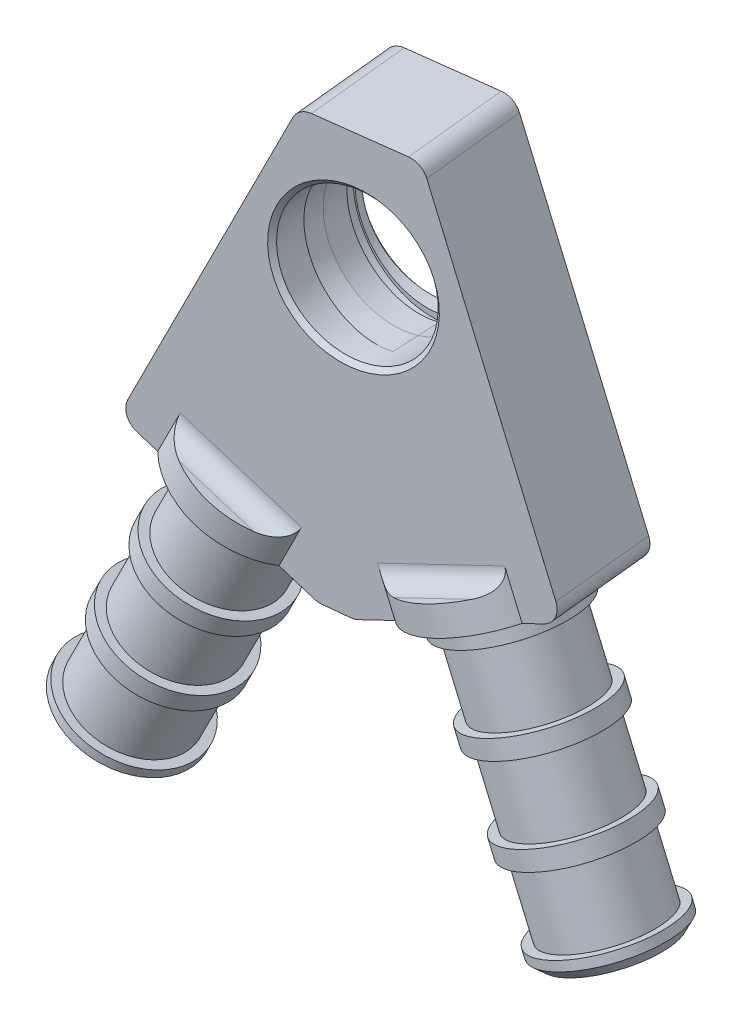
from build123d import *

# Parameters (mm, degrees)
BOSS_EXTRUDE1_DEPTH     = 6
FILLET1_R               = 2
SKETCH2_R               = 9.000000000000037
BOSS_EXTRUDE2_DEPTH     = 3
SKETCH4_R               = 5.999999999999989
BOSS_EXTRUDE4_DEPTH     = 31
SKETCH7_R               = 7.000000000000042
SKETCH7_R_2             = 6.0000000000002185
BOSS_EXTRUDE5_DEPTH     = 2
LPATTERN1_COUNT         = 4
LPATTERN1_PITCH         = 9.666666666666666
CHAMFER1_SIZE           = 1
SKETCH10_R              = 8.999999999999813
BOSS_EXTRUDE6_DEPTH     = 3
SKETCH11_R              = 6.000000000000097
BOSS_EXTRUDE7_DEPTH     = 31
SKETCH12_R              = 6.999999999999927
SKETCH12_R_2            = 6.000000000000561
BOSS_EXTRUDE8_DEPTH     = 2
LPATTERN2_COUNT         = 4
LPATTERN2_PITCH         = 9.666666666666666
CHAMFER2_SIZE           = 1
FILLET2_R               = 2
CHAMFER3_SIZE           = 0.5
CUT_EXTRUDE1_DEPTH      = 3
CUT_EXTRUDE1_DEPTH_BACK = 2
SKETCH14_R              = 7.999999999999987
CUT_EXTRUDE2_START      = -2.5
SKETCH15_R              = 8.75000000000004
CUT_EXTRUDE2_DEPTH      = 1.05


with BuildPart() as part:
    # Sketch1 → Boss-Extrude1 (new, symmetric)
    with BuildSketch(Plane(origin=(40.22848605021182, 10.507440386249398, 304.21541689712456), x_dir=(0.9913798815676159, -0.004522624098671365, -0.13094073580915158), z_dir=(0.13101881705686366, 0.03422133281336, 0.9907890643106118))):
        with BuildLine():
            Line((1125.7923568942253, 582.4609465073789), (1113.5581017730187, 582.460946507379))
            Line((1113.5581017730187, 582.460946507379), (1096.8813358766208, 546.245672674871))
            Line((1096.8813358766208, 546.245672674871), (1106.8728718457214, 541.6446718078677))
            Line((1106.8728718457214, 541.6446718078674), (1116.074873579728, 561.6277437460691))
            ThreePointArc((1116.0748735797279, 561.6277437460692), (1115.106514314083, 575.631134327019), (1127.4210560284578, 568.8943153599605))
            ThreePointArc((1127.4210560284578, 568.8943153599605), (1126.0556576867325, 564.424185514417), (1122.425540819453, 561.479932638474))
            Line((1122.425540819453, 561.4799326384739), (1130.68787399469, 541.090380154386))
            Line((1130.68787399469, 541.090380154386), (1140.8826502367342, 545.2215467420046))
            Line((1140.8826502367342, 545.2215467420046), (1125.7923568942253, 582.4609465073789))
        make_face()
        with BuildLine():
            Line((1116.074873579728, 561.6277437460691), (1106.8728718457214, 541.6446718078674))
            Line((1106.8728718457214, 541.6446718078677), (1116.8644078148222, 537.0436709408642))
            Line((1116.8644078148222, 537.0436709408642), (1120.4930977526462, 536.9592135667675))
            Line((1120.4930977526462, 536.9592135667675), (1130.68787399469, 541.090380154386))
            Line((1130.68787399469, 541.090380154386), (1122.425540819453, 561.4799326384739))
            ThreePointArc((1122.425540819453, 561.479932638474), (1119.2349072889845, 560.896481362759), (1116.0748735797279, 561.6277437460692))
        make_face()
    extrude(amount=BOSS_EXTRUDE1_DEPTH, both=True)

    # Fillet1
    fillet1_edges = [part.edges().sort_by_distance(p)[0] for p in [
        (1147.4653903967558, 542.1798998731624, 139.43421828086267),
        (1128.0476313564752, 551.5694575543945, 144.70554073394916),
        (1144.580641555777, 587.6877259897925, 141.2717616925557),
        (1155.9233230465654, 587.4270670558717, 133.72506493904436),
        (1170.8835362732825, 550.1416125523617, 133.03459355934973),
        (1151.0628005975614, 542.0790816312547, 138.96199032516412),
    ]]
    fillet(fillet1_edges, radius=FILLET1_R)

    # Sketch2 → Boss-Extrude2 (add)
    with BuildSketch(Plane(origin=(395.9915846248843, 865.0893079497423, -82.24440603747578), x_dir=(-0.9099731182582202, 0.41280589206970897, -0.03924563058409188), z_dir=(-0.41466724496566065, -0.9058884428480648, 0.08612319703132973))):
        with Locations((-814.9344009695442, -191.70601494572279)):
            Circle(SKETCH2_R)
    extrude(amount=-BOSS_EXTRUDE2_DEPTH)

    # Sketch4 → Boss-Extrude4 (add)
    with BuildSketch(Plane(origin=(395.9915846248843, 865.0893079497423, -82.24440603747578), x_dir=(-0.9099731182582202, 0.41280589206970897, -0.03924563058409188), z_dir=(-0.41466724496566065, -0.9058884428480648, 0.08612319703132973))):
        with Locations(Location((-814.9344009695399, -191.7060149457234, 0), (0, 0, 177.742421012))):
            Circle(SKETCH4_R)
    extrude(amount=BOSS_EXTRUDE4_DEPTH)

    # Sketch7 → Boss-Extrude5 (add)
    with BuildSketch(Plane(origin=(395.9915846248843, 865.0893079497423, -82.24440603747578), x_dir=(-0.9099731182582202, 0.41280589206970897, -0.03924563058409188), z_dir=(-0.41466724496566065, -0.9058884428480648, 0.08612319703132973))):
        with Locations(Location((-814.9344009695399, -191.7060149457234, 0), (0, 0, 177.742421012))):
            Circle(SKETCH7_R)
        with Locations(Location((-814.9344009695399, -191.7060149457234, 0), (0, 0, 177.742421012))):
            Circle(SKETCH7_R_2, mode=Mode.SUBTRACT)
    boss_extrude5 = extrude(amount=BOSS_EXTRUDE5_DEPTH)

    # LPattern1: Boss-Extrude5 ×4
    with Locations(*[Vector(-0.41466724496565566, -0.9058884428480669, 0.08612319703133149) * (i * LPATTERN1_PITCH) for i in range(1, LPATTERN1_COUNT)]):
        add(boss_extrude5)

    # Chamfer1
    chamfer1_edges = [part.edges().sort_by_distance(p)[0] for p in [
        (1118.3404302588897, 521.654300809395, 143.25351501891666),
    ]]
    chamfer(chamfer1_edges, length=CHAMFER1_SIZE)

    # Sketch9 → Cut-Revolve1 (revolve, cut)
    with BuildSketch(Plane(origin=(701.3399119759364, -328.7734016214342, -81.38731494870906), x_dir=(0.09461756399583972, -0.04435472420271057, 0.9945251002485532), z_dir=(-0.900491613247789, 0.42213153103599016, 0.10449796637066838))):
        with BuildLine():
            Line((225.877486562659, 947.0804844817654), (230.36058184932747, 947.4701723705318))
            Line((230.36058184932747, 947.4701723705318), (228.51317259887966, 968.7233648406637))
            ThreePointArc((228.51317259887966, 968.7233648406637), (226.92455344142695, 971.779254978499), (223.64038942344484, 972.8167722385658))
            Line((223.64038942344484, 972.8167722385658), (225.877486562659, 947.0804844817654))
        make_face()
    revolve(axis=Axis((1135.417535218711, 542.1429230931792, 141.0286657622679), (-0.41466724496565976, -0.9058884428480652, 0.08612319703132981)), mode=Mode.SUBTRACT)

    # Sketch10 → Boss-Extrude6 (add)
    with BuildSketch(Plane(origin=(-28.60916021936566, 71.30283008518833, 1.3204227793553287), x_dir=(-0.9281031291481225, -0.3722593970186158, -0.006893692537381721), z_dir=(0.3723232220335758, -0.9279440302990668, -0.017184148709241842))):
        with Locations((-1281.9468219791854, -127.34853607341212)):
            Circle(SKETCH10_R)
    extrude(amount=-BOSS_EXTRUDE6_DEPTH)

    # Sketch11 → Boss-Extrude7 (add)
    with BuildSketch(Plane(origin=(-28.60916021936566, 71.30283008518833, 1.3204227793553287), x_dir=(-0.9281031291481225, -0.3722593970186158, -0.006893692537381721), z_dir=(0.3723232220335758, -0.9279440302990668, -0.017184148709241842))):
        with Locations(Location((-1281.9468219791854, -127.34853607341212, 0), (0, 0, 179.604959052))):
            Circle(SKETCH11_R)
    extrude(amount=BOSS_EXTRUDE7_DEPTH)

    # Sketch12 → Boss-Extrude8 (add)
    with BuildSketch(Plane(origin=(-28.60916021936566, 71.30283008518833, 1.3204227793553287), x_dir=(-0.9281031291481225, -0.3722593970186158, -0.006893692537381721), z_dir=(0.3723232220335758, -0.9279440302990668, -0.017184148709241842))):
        with Locations(Location((-1281.9468219791854, -127.34853607341212, 0), (0, 0, 179.604959052))):
            Circle(SKETCH12_R)
        with Locations(Location((-1281.9468219791854, -127.34853607341212, 0), (0, 0, 179.604959052))):
            Circle(SKETCH12_R_2, mode=Mode.SUBTRACT)
    boss_extrude8 = extrude(amount=BOSS_EXTRUDE8_DEPTH)

    # LPattern2: Boss-Extrude8 ×4
    with Locations(*[Vector(0.3723232220336152, -0.9279440302990509, -0.01718414870924285) * (i * LPATTERN2_PITCH) for i in range(1, LPATTERN2_COUNT)]):
        add(boss_extrude8)

    # Chamfer2
    chamfer2_edges = [part.edges().sort_by_distance(p)[0] for p in [
        (1166.2151490592937, 514.788766704171, 136.95176692871334),
    ]]
    chamfer(chamfer2_edges, length=CHAMFER2_SIZE)

    # Sketch13 → Cut-Revolve2 (revolve, cut)
    with BuildSketch(Plane(origin=(1149.5503708301608, 464.3514086195921, -168.0513641377568), x_dir=(0.37232322203357693, -0.9279440302990664, -0.01718414870924198), z_dir=(0.9188087330405366, 0.37114522361577396, -0.1343195260401155)), mode=Mode.PRIVATE) as cut_revolve2_sk:
        with BuildLine():
            Line((-45.83958057492598, -307.04357552512596), (-45.83958057492598, -302.54357552512596))
            Line((-45.83958057492598, -302.54357552512596), (-67.17291390825942, -302.54357552512596))
            ThreePointArc((-67.17291390825942, -302.54357552512596), (-70.35489442359888, -303.86159500978647), (-71.67291390825942, -307.04357552512596))
            Line((-71.67291390825942, -307.04357552512596), (-45.83958057492598, -307.04357552512596))
        make_face()
    revolve(cut_revolve2_sk.sketch.rotate(Axis((1163.0933666415144, 541.3673016011497, 137.3956907703916), (0.37232322203357254, -0.927944030299068, -0.017184148709241166)), 277.720420161), axis=Axis((1163.0933666415144, 541.3673016011497, 137.3956907703916), (0.37232322203357254, -0.927944030299068, -0.017184148709241166)), mode=Mode.SUBTRACT)

    # Fillet2
    fillet2_edges = [part.edges().sort_by_distance(p)[0] for p in [
        (1159.2666140925658, 548.7401831850455, 131.59129359898685),
        (1160.8388398972481, 549.1508391788058, 143.4807623707142),
        (1138.0178714835909, 549.335684046224, 134.38059193398155),
        (1139.5900972882732, 549.7463400399843, 146.27006070570894),
    ]]
    fillet(fillet2_edges, radius=FILLET2_R)

    # Chamfer3
    chamfer3_edges = [part.edges().sort_by_distance(p)[0] for p in [
        (1146.5087630485255, 580.9576451769952, 144.27713614156175),
        (1144.9365372438433, 580.5469891832349, 132.3876673698344),
    ]]
    chamfer(chamfer3_edges, length=CHAMFER3_SIZE)

    # Sketch14 → Cut-Extrude1 (cut, two sides: drawn at the far end of the back side and taken through both)
    with BuildSketch(Plane.XY.offset(138).offset(-CUT_EXTRUDE1_DEPTH_BACK)):
        with Locations((1150, 574.0000000000001)):
            Circle(SKETCH14_R)
    extrude(amount=CUT_EXTRUDE1_DEPTH + CUT_EXTRUDE1_DEPTH_BACK, mode=Mode.SUBTRACT)

    # Sketch15 → Cut-Extrude2 (cut)
    with BuildSketch(Plane.XY.offset(138).offset(CUT_EXTRUDE2_START)):
        with Locations((1150, 574.0000000000001)):
            Circle(SKETCH15_R)
    extrude(amount=-CUT_EXTRUDE2_DEPTH, mode=Mode.SUBTRACT)


solid = part.part
